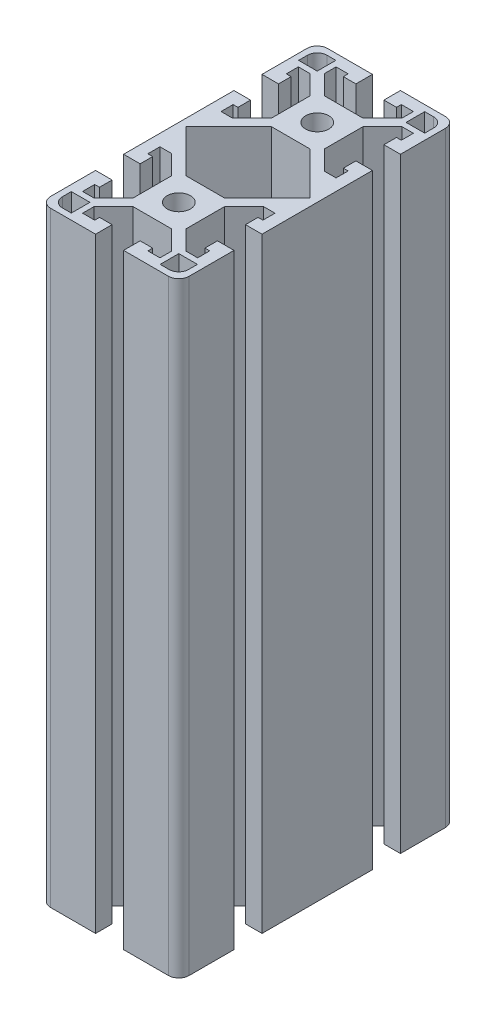
from build123d import *

# Parameters (mm, degrees)
SKETCH2_R                            = 3.35
F_40_SERIES_TS40_80LM_650037_1_DEPTH = 175


with BuildPart() as part:
    # Sketch2 → 40 series TS40-80LM-650037(1) (new body)
    with BuildSketch(Plane(origin=(0, 0, 0), x_dir=(-1, 0, 0), z_dir=(0, 1, 0))):
        with BuildLine():
            Line((0, -27.681), (-5.525738531, -27.681))
            Line((-5.525738531, -27.681), (-11.176, -33.331261469))
            Line((-11.176, -33.331261469), (-11.176, -36.6218))
            Line((-11.176, -36.6218), (-7.6835, -36.6218))
            Line((-7.6835, -36.6218), (-7.6835, -35.2248))
            Line((-7.6835, -35.2248), (-4.0488, -35.2248))
            Line((-4.0488, -35.2248), (-4.0488, -40))
            Line((-4.0488, -40), (-17, -40))
            ThreePointArc((-17, -40), (-19.121320344, -39.121320344), (-20, -37))
            Line((-20, -37), (-20, -24.0488))
            Line((-20, -24.0488), (-15.2248, -24.0488))
            Line((-15.2248, -24.0488), (-15.2248, -27.6835))
            Line((-15.2248, -27.6835), (-16.6218, -27.6835))
            Line((-16.6218, -27.6835), (-16.6218, -31.176))
            Line((-16.6218, -31.176), (-13.331261469, -31.176))
            Line((-13.331261469, -31.176), (-7.681, -25.525738531))
            Line((-7.681, -25.525738531), (-7.681, -20))
            Line((-7.681, -20), (-7.681, -14.474261469))
            Line((-7.681, -14.474261469), (-13.331261469, -8.824))
            Line((-13.331261469, -8.824), (-16.6218, -8.824))
            Line((-16.6218, -8.824), (-16.6218, -12.3165))
            Line((-16.6218, -12.3165), (-15.2248, -12.3165))
            Line((-15.2248, -12.3165), (-15.2248, -15.9512))
            Line((-15.2248, -15.9512), (-20, -15.9512))
            Line((-20, -15.9512), (-20, 15.9512))
            Line((-20, 15.9512), (-15.2248, 15.9512))
            Line((-15.2248, 15.9512), (-15.2248, 12.3165))
            Line((-15.2248, 12.3165), (-16.6218, 12.3165))
            Line((-16.6218, 12.3165), (-16.6218, 8.824))
            Line((-16.6218, 8.824), (-13.331261469, 8.824))
            Line((-13.331261469, 8.824), (-7.681, 14.474261469))
            Line((-7.681, 14.474261469), (-7.681, 25.525738531))
            Line((-7.681, 25.525738531), (-13.331261469, 31.176))
            Line((-13.331261469, 31.176), (-16.6218, 31.176))
            Line((-16.6218, 31.176), (-16.6218, 27.6835))
            Line((-16.6218, 27.6835), (-15.2248, 27.6835))
            Line((-15.2248, 27.6835), (-15.2248, 24.0488))
            Line((-15.2248, 24.0488), (-20, 24.0488))
            Line((-20, 24.0488), (-20, 37))
            ThreePointArc((-20, 37), (-19.121320344, 39.121320344), (-17, 40))
            Line((-17, 40), (-4.0488, 40))
            Line((-4.0488, 40), (-4.0488, 35.2248))
            Line((-4.0488, 35.2248), (-7.6835, 35.2248))
            Line((-7.6835, 35.2248), (-7.6835, 36.6218))
            Line((-7.6835, 36.6218), (-11.176, 36.6218))
            Line((-11.176, 36.6218), (-11.176, 33.331261469))
            Line((-11.176, 33.331261469), (-5.525738531, 27.681))
            Line((-5.525738531, 27.681), (0, 27.681))
            Line((0, 27.681), (5.525738531, 27.681))
            Line((5.525738531, 27.681), (11.176, 33.331261469))
            Line((11.176, 33.331261469), (11.176, 36.6218))
            Line((11.176, 36.6218), (7.6835, 36.6218))
            Line((7.6835, 36.6218), (7.6835, 35.2248))
            Line((7.6835, 35.2248), (4.0488, 35.2248))
            Line((4.0488, 35.2248), (4.0488, 40))
            Line((4.0488, 40), (17, 40))
            ThreePointArc((17, 40), (19.121320344, 39.121320344), (20, 37))
            Line((20, 37), (20, 24.0488))
            Line((20, 24.0488), (15.2248, 24.0488))
            Line((15.2248, 24.0488), (15.2248, 27.6835))
            Line((15.2248, 27.6835), (16.6218, 27.6835))
            Line((16.6218, 27.6835), (16.6218, 31.176))
            Line((16.6218, 31.176), (13.331261469, 31.176))
            Line((13.331261469, 31.176), (7.681, 25.525738531))
            Line((7.681, 25.525738531), (7.681, 20))
            Line((7.681, 20), (7.681, 14.474261469))
            Line((7.681, 14.474261469), (13.331261469, 8.824))
            Line((13.331261469, 8.824), (16.6218, 8.824))
            Line((16.6218, 8.824), (16.6218, 12.3165))
            Line((16.6218, 12.3165), (15.2248, 12.3165))
            Line((15.2248, 12.3165), (15.2248, 15.9512))
            Line((15.2248, 15.9512), (20, 15.9512))
            Line((20, 15.9512), (20, -15.9512))
            Line((20, -15.9512), (15.2248, -15.9512))
            Line((15.2248, -15.9512), (15.2248, -12.3165))
            Line((15.2248, -12.3165), (16.6218, -12.3165))
            Line((16.6218, -12.3165), (16.6218, -8.824))
            Line((16.6218, -8.824), (13.331261469, -8.824))
            Line((13.331261469, -8.824), (7.681, -14.474261469))
            Line((7.681, -14.474261469), (7.681, -20))
            Line((7.681, -20), (7.681, -25.525738531))
            Line((7.681, -25.525738531), (13.331261469, -31.176))
            Line((13.331261469, -31.176), (16.6218, -31.176))
            Line((16.6218, -31.176), (16.6218, -27.6835))
            Line((16.6218, -27.6835), (15.2248, -27.6835))
            Line((15.2248, -27.6835), (15.2248, -24.0488))
            Line((15.2248, -24.0488), (20, -24.0488))
            Line((20, -24.0488), (20, -37))
            ThreePointArc((20, -37), (19.121320344, -39.121320344), (17, -40))
            Line((17, -40), (4.0488, -40))
            Line((4.0488, -40), (4.0488, -35.2248))
            Line((4.0488, -35.2248), (7.6835, -35.2248))
            Line((7.6835, -35.2248), (7.6835, -36.6218))
            Line((7.6835, -36.6218), (11.176, -36.6218))
            Line((11.176, -36.6218), (11.176, -33.331261469))
            Line((11.176, -33.331261469), (5.525738531, -27.681))
            Line((5.525738531, -27.681), (0, -27.681))
        make_face()
        with Locations((0, -20)):
            Circle(SKETCH2_R, mode=Mode.SUBTRACT)
        with Locations((0, 20)):
            Circle(SKETCH2_R, mode=Mode.SUBTRACT)
        Polygon((-5.525738531, 12.319), (-17.844738531, 0), (-5.525738531, -12.319), (0, -12.319), (5.525738531, -12.319), (17.844738531, 0), (5.525738531, 12.319), (0, 12.319), align=None, mode=Mode.SUBTRACT)
        with BuildLine():
            Line((12.8372, 38.222), (12.8372, 32.8372))
            Line((12.8372, 32.8372), (18.222, 32.8372))
            Line((18.222, 32.8372), (18.222, 35.428))
            ThreePointArc((18.222, 35.428), (17.403656347, 37.403656347), (15.428, 38.222))
            Line((15.428, 38.222), (12.8372, 38.222))
        make_face(mode=Mode.SUBTRACT)
        with BuildLine():
            Line((12.8372, -32.8372), (18.222, -32.8372))
            Line((18.222, -32.8372), (18.222, -35.428))
            ThreePointArc((18.222, -35.428), (17.403656347, -37.403656347), (15.428, -38.222))
            Line((15.428, -38.222), (12.8372, -38.222))
            Line((12.8372, -38.222), (12.8372, -32.8372))
        make_face(mode=Mode.SUBTRACT)
        with BuildLine():
            Line((-12.8372, -38.222), (-12.8372, -32.8372))
            Line((-12.8372, -32.8372), (-18.222, -32.8372))
            Line((-18.222, -32.8372), (-18.222, -35.428))
            ThreePointArc((-18.222, -35.428), (-17.403656347, -37.403656347), (-15.428, -38.222))
            Line((-15.428, -38.222), (-12.8372, -38.222))
        make_face(mode=Mode.SUBTRACT)
        with BuildLine():
            Line((-18.222, 35.428), (-18.222, 32.8372))
            Line((-18.222, 32.8372), (-12.8372, 32.8372))
            Line((-12.8372, 32.8372), (-12.8372, 38.222))
            Line((-12.8372, 38.222), (-15.428, 38.222))
            ThreePointArc((-15.428, 38.222), (-17.403656347, 37.403656347), (-18.222, 35.428))
        make_face(mode=Mode.SUBTRACT)
    extrude(amount=F_40_SERIES_TS40_80LM_650037_1_DEPTH)


solid = part.part
